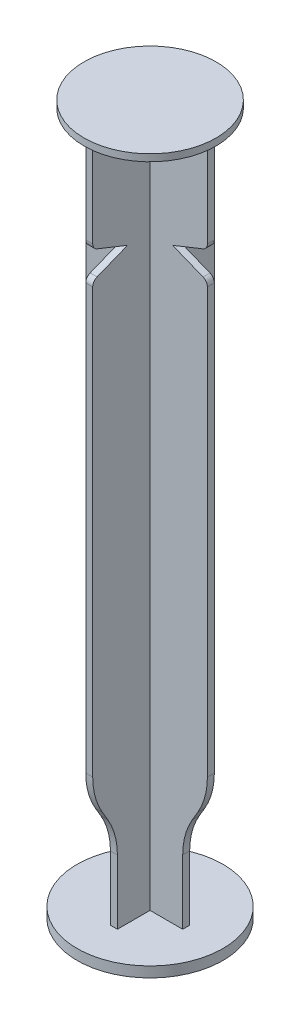
from build123d import *

# Parameters (mm, degrees)
EXTRUDE_1_DEPTH          = 0.5
PATTERN_CIRCULAR_1_COUNT = 2
PATTERN_CIRCULAR_1_ANGLE = 90
SKETCH_3_R               = 9.5
EXTRUDE_2_DEPTH          = 1
SKETCH_4_R               = 10.5
EXTRUDE_3_DEPTH          = 1.5


with BuildPart() as part:
    # Эскиз1 → Бобышка-Вытянуть1 (new, symmetric)
    with BuildSketch(Plane.XY):
        with BuildLine():
            Line((-8.75, 0), (8.75, 0))
            Line((8.75, 0), (8.75, -12.322967039))
            ThreePointArc((8.75, -12.322967039), (8.57806723, -12.883595848), (8.121390676, -13.251443729))
            Line((8.121390676, -13.251443729), (3.75, -15))
            Line((3.75, -15), (8.121390676, -16.748556271))
            ThreePointArc((8.121390676, -16.748556271), (8.57806723, -17.116404152), (8.75, -17.677032961))
            Line((8.75, -17.677032961), (8.75, -78.763241336))
            ThreePointArc((8.75, -78.763241336), (8.395311893, -81.402930425), (7.356408303, -83.855366249))
            Line((7.356408303, -83.855366249), (6.593591697, -85.144633751))
            ThreePointArc((6.593591697, -85.144633751), (5.554688107, -87.597069575), (5.2, -90.236758664))
            Line((5.2, -90.236758664), (5.2, -99.5))
            Line((5.2, -99.5), (-5.2, -99.5))
            Line((-5.2, -99.5), (-5.2, -90.236758664))
            ThreePointArc((-5.2, -90.236758664), (-5.554688107, -87.597069575), (-6.593591697, -85.144633751))
            Line((-6.593591697, -85.144633751), (-7.356408303, -83.855366249))
            ThreePointArc((-7.356408303, -83.855366249), (-8.395311893, -81.402930425), (-8.75, -78.763241336))
            Line((-8.75, -78.763241336), (-8.75, -17.677032961))
            ThreePointArc((-8.75, -17.677032961), (-8.57806723, -17.116404152), (-8.121390676, -16.748556271))
            Line((-8.121390676, -16.748556271), (-3.75, -15))
            Line((-3.75, -15), (-8.121390676, -13.251443729))
            ThreePointArc((-8.121390676, -13.251443729), (-8.57806723, -12.883595848), (-8.75, -12.322967039))
            Line((-8.75, -12.322967039), (-8.75, 0))
        make_face()
    extrude_1 = extrude(amount=EXTRUDE_1_DEPTH, both=True)

    # Круговой массив1: Бобышка-Вытянуть1 ×2 about axis
    pattern_circular_1_axis = Axis((0, 0, 0), (0, 1, 0))
    for i in range(1, PATTERN_CIRCULAR_1_COUNT):
        add(extrude_1.rotate(pattern_circular_1_axis, i * PATTERN_CIRCULAR_1_ANGLE / (PATTERN_CIRCULAR_1_COUNT - 1)))

    # Эскиз3 → Бобышка-Вытянуть2 (add)
    with BuildSketch(Plane(origin=(0, 0, 0), x_dir=(1, 0, 0), z_dir=(0, 1, 0))):
        with Locations(Location((0, 0, 0), (0, 0, 270))):
            Circle(SKETCH_3_R)
    extrude(amount=EXTRUDE_2_DEPTH)

    # Эскиз4 → Бобышка-Вытянуть3 (add)
    with BuildSketch(Plane.XZ.offset(99.5)):
        with Locations(Location((0, 0, 0), (0, 0, 270))):
            Circle(SKETCH_4_R)
    extrude(amount=EXTRUDE_3_DEPTH)


solid = part.part
